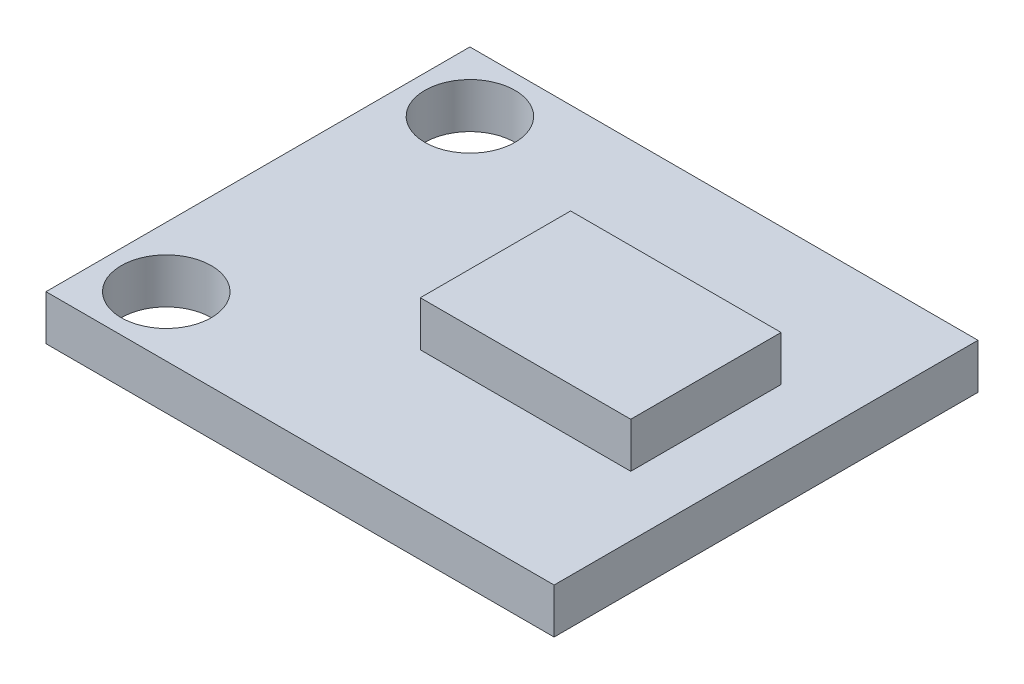
from build123d import *

# Parameters (mm, degrees)
SKETCH1_W           = 16.9
SKETCH1_H           = 14.1
SKETCH1_R           = 1.5
BOSS_EXTRUDE1_DEPTH = 1.5
SKETCH2_W           = 7
SKETCH2_H           = 5
BOSS_EXTRUDE2_DEPTH = 1.5


with BuildPart() as part:
    # Sketch1 → Boss-Extrude1 (new body)
    with BuildSketch(Plane(origin=(0, 0, 0), x_dir=(1, 0, 0), z_dir=(0, 1, 0))):
        Rectangle(SKETCH1_W, SKETCH1_H)
        with Locations(Location((-6.45, 5.05, 0), (0, 0, 270))):
            Circle(SKETCH1_R, mode=Mode.SUBTRACT)
        with Locations(Location((-6.45, -5.05, 0), (0, 0, 90))):
            Circle(SKETCH1_R, mode=Mode.SUBTRACT)
    extrude(amount=BOSS_EXTRUDE1_DEPTH)

    # Sketch2 → Boss-Extrude2 (add)
    with BuildSketch(Plane(origin=(0, 1.5, 0), x_dir=(1, 0, 0), z_dir=(0, 1, 0))):
        with Locations((2.95, 0)):
            Rectangle(SKETCH2_W, SKETCH2_H)
    extrude(amount=BOSS_EXTRUDE2_DEPTH)


solid = part.part
